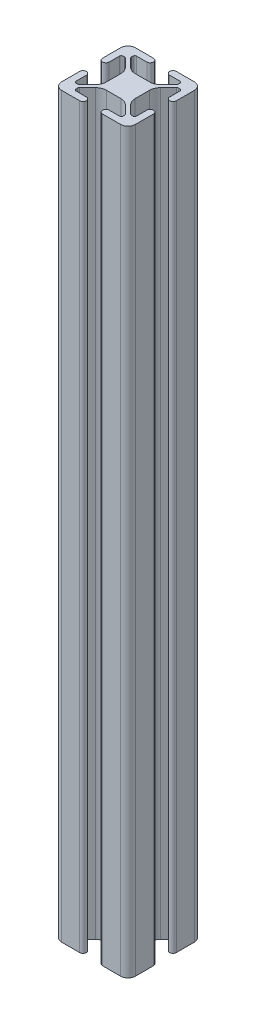
from build123d import *

# Parameters (mm, degrees)
EXTRUDE_1_DEPTH = 200


with BuildPart() as part:
    # 草图1 → 凸台-拉伸1 (new body)
    with BuildSketch(Plane(origin=(0, 0, 0), x_dir=(1, 0, 0), z_dir=(0, 1, 0))):
        with BuildLine():
            Line((-1.042752475, -10.085861632), (3.857247525, -10.085861632))
            ThreePointArc((3.857247525, -10.085861632), (4.757247525, -10.985861632), (3.857247525, -11.885861632))
            Line((3.857247525, -11.885861632), (1.076161722, -11.885861632))
            ThreePointArc((1.076161722, -11.885861632), (0.722608332, -12.032308241), (0.576161722, -12.385861632))
            Line((0.576161722, -12.385861632), (0.576161722, -12.790788968))
            ThreePointArc((0.576161722, -12.790788968), (0.614221956, -12.982130685), (0.722608332, -13.144342359))
            Line((0.722608332, -13.144342359), (2.885447948, -15.307181975))
            ThreePointArc((2.885447948, -15.307181975), (3.858717994, -15.957500229), (5.006768291, -16.185861632))
            Line((5.006768291, -16.185861632), (8.907726758, -16.185861632))
            ThreePointArc((8.907726758, -16.185861632), (10.055777055, -15.957500229), (11.029047102, -15.307181975))
            Line((11.029047102, -15.307181975), (13.191886718, -13.144342359))
            ThreePointArc((13.191886718, -13.144342359), (13.300273094, -12.982130685), (13.338333327, -12.790788968))
            Line((13.338333327, -12.790788968), (13.338333327, -12.385861632))
            ThreePointArc((13.338333327, -12.385861632), (13.191886718, -12.032308241), (12.838333327, -11.885861632))
            Line((12.838333327, -11.885861632), (10.057247525, -11.885861632))
            ThreePointArc((10.057247525, -11.885861632), (9.157247525, -10.985861632), (10.057247525, -10.085861632))
            Line((10.057247525, -10.085861632), (14.957247525, -10.085861632))
            ThreePointArc((14.957247525, -10.085861632), (16.371461087, -10.671648069), (16.957247525, -12.085861632))
            Line((16.957247525, -12.085861632), (16.957247525, -16.985861632))
            ThreePointArc((16.957247525, -16.985861632), (16.057247525, -17.885861632), (15.157247525, -16.985861632))
            Line((15.157247525, -16.985861632), (15.157247525, -14.204775829))
            ThreePointArc((15.157247525, -14.204775829), (15.010800915, -13.851222438), (14.657247525, -13.704775829))
            Line((14.657247525, -13.704775829), (14.252320188, -13.704775829))
            ThreePointArc((14.252320188, -13.704775829), (14.060978472, -13.742836063), (13.898766797, -13.851222438))
            Line((13.898766797, -13.851222438), (11.735927181, -16.014062054))
            ThreePointArc((11.735927181, -16.014062054), (11.085608927, -16.987332101), (10.857247525, -18.135382398))
            Line((10.857247525, -18.135382398), (10.857247525, -22.036340865))
            ThreePointArc((10.857247525, -22.036340865), (11.085608927, -23.184391162), (11.735927181, -24.157661209))
            Line((11.735927181, -24.157661209), (13.898766797, -26.320500825))
            ThreePointArc((13.898766797, -26.320500825), (14.060978472, -26.4288872), (14.252320188, -26.466947434))
            Line((14.252320188, -26.466947434), (14.657247525, -26.466947434))
            ThreePointArc((14.657247525, -26.466947434), (15.010800915, -26.320500825), (15.157247525, -25.966947434))
            Line((15.157247525, -25.966947434), (15.157247525, -23.185861632))
            ThreePointArc((15.157247525, -23.185861632), (16.057247525, -22.285861632), (16.957247525, -23.185861632))
            Line((16.957247525, -23.185861632), (16.957247525, -28.085861632))
            ThreePointArc((16.957247525, -28.085861632), (16.371461087, -29.500075194), (14.957247525, -30.085861632))
            Line((14.957247525, -30.085861632), (10.057247525, -30.085861632))
            ThreePointArc((10.057247525, -30.085861632), (9.157247525, -29.185861632), (10.057247525, -28.285861632))
            Line((10.057247525, -28.285861632), (12.838333327, -28.285861632))
            ThreePointArc((12.838333327, -28.285861632), (13.191886718, -28.139415022), (13.338333327, -27.785861632))
            Line((13.338333327, -27.785861632), (13.338333327, -27.380934295))
            ThreePointArc((13.338333327, -27.380934295), (13.300273094, -27.189592579), (13.191886718, -27.027380904))
            Line((13.191886718, -27.027380904), (11.029047102, -24.864541288))
            ThreePointArc((11.029047102, -24.864541288), (10.055777055, -24.214223034), (8.907726758, -23.985861632))
            Line((8.907726758, -23.985861632), (5.006768291, -23.985861632))
            ThreePointArc((5.006768291, -23.985861632), (3.858717994, -24.214223034), (2.885447948, -24.864541288))
            Line((2.885447948, -24.864541288), (0.722608332, -27.027380904))
            ThreePointArc((0.722608332, -27.027380904), (0.614221956, -27.189592579), (0.576161722, -27.380934295))
            Line((0.576161722, -27.380934295), (0.576161722, -27.785861632))
            ThreePointArc((0.576161722, -27.785861632), (0.722608332, -28.139415022), (1.076161722, -28.285861632))
            Line((1.076161722, -28.285861632), (3.857247525, -28.285861632))
            ThreePointArc((3.857247525, -28.285861632), (4.757247525, -29.185861632), (3.857247525, -30.085861632))
            Line((3.857247525, -30.085861632), (-1.042752475, -30.085861632))
            ThreePointArc((-1.042752475, -30.085861632), (-2.456966038, -29.500075194), (-3.042752475, -28.085861632))
            Line((-3.042752475, -28.085861632), (-3.042752475, -23.185861632))
            ThreePointArc((-3.042752475, -23.185861632), (-2.142752475, -22.285861632), (-1.242752475, -23.185861632))
            Line((-1.242752475, -23.185861632), (-1.242752475, -25.966947434))
            ThreePointArc((-1.242752475, -25.966947434), (-1.096305866, -26.320500825), (-0.742752475, -26.466947434))
            Line((-0.742752475, -26.466947434), (-0.337825138, -26.466947434))
            ThreePointArc((-0.337825138, -26.466947434), (-0.146483422, -26.4288872), (0.015728252, -26.320500825))
            Line((0.015728252, -26.320500825), (2.178567868, -24.157661209))
            ThreePointArc((2.178567868, -24.157661209), (2.828886122, -23.184391162), (3.057247525, -22.036340865))
            Line((3.057247525, -22.036340865), (3.057247525, -18.135382398))
            ThreePointArc((3.057247525, -18.135382398), (2.828886122, -16.987332101), (2.178567868, -16.014062054))
            Line((2.178567868, -16.014062054), (0.015728252, -13.851222438))
            ThreePointArc((0.015728252, -13.851222438), (-0.146483422, -13.742836063), (-0.337825138, -13.704775829))
            Line((-0.337825138, -13.704775829), (-0.742752475, -13.704775829))
            ThreePointArc((-0.742752475, -13.704775829), (-1.096305866, -13.851222438), (-1.242752475, -14.204775829))
            Line((-1.242752475, -14.204775829), (-1.242752475, -16.985861632))
            ThreePointArc((-1.242752475, -16.985861632), (-2.142752475, -17.885861632), (-3.042752475, -16.985861632))
            Line((-3.042752475, -16.985861632), (-3.042752475, -12.085861632))
            ThreePointArc((-3.042752475, -12.085861632), (-2.456966038, -10.671648069), (-1.042752475, -10.085861632))
        make_face()
    extrude(amount=EXTRUDE_1_DEPTH)


solid = part.part
